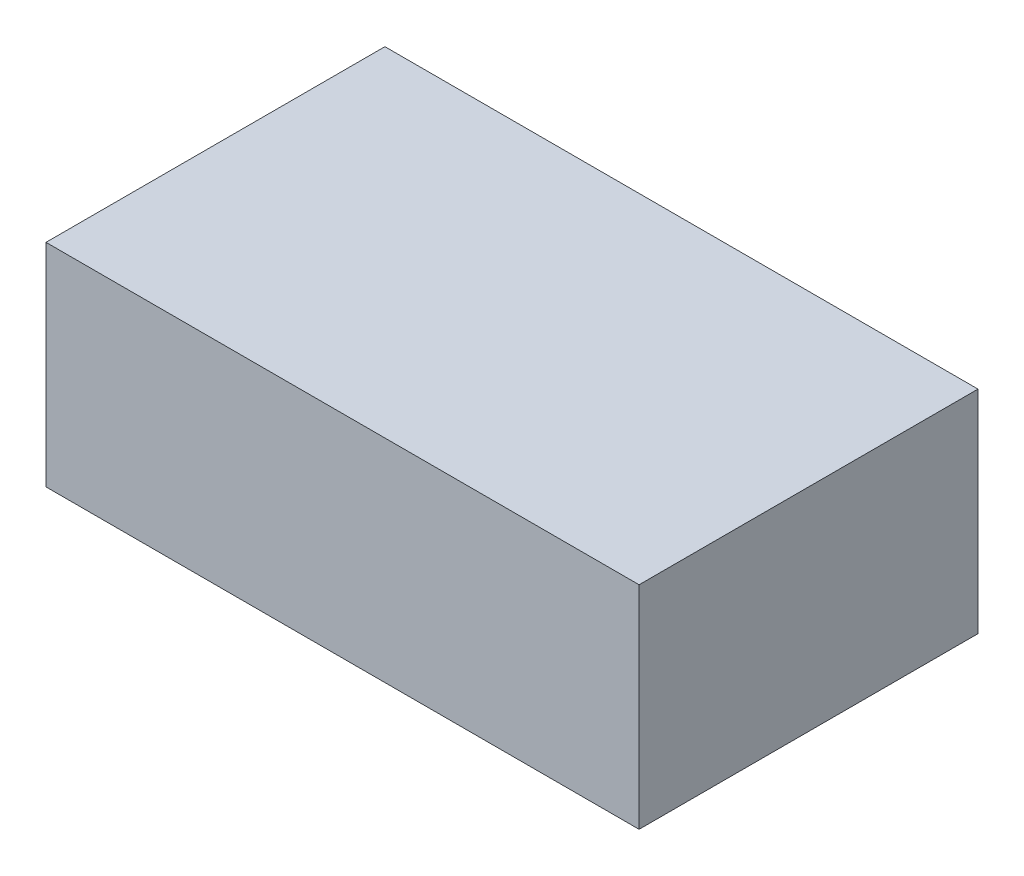
from build123d import *

# Parameters (mm, degrees)
SKETCH1_W           = 44.45
SKETCH1_H           = 25.4
BOSS_EXTRUDE1_DEPTH = 15.875


with BuildPart() as part:
    # Sketch1 → Boss-Extrude1 (new body)
    with BuildSketch(Plane(origin=(0, 0, 0), x_dir=(1, 0, 0), z_dir=(0, 1, 0))):
        with Locations((-22.225, 12.7)):
            Rectangle(SKETCH1_W, SKETCH1_H)
    extrude(amount=BOSS_EXTRUDE1_DEPTH)


solid = part.part
